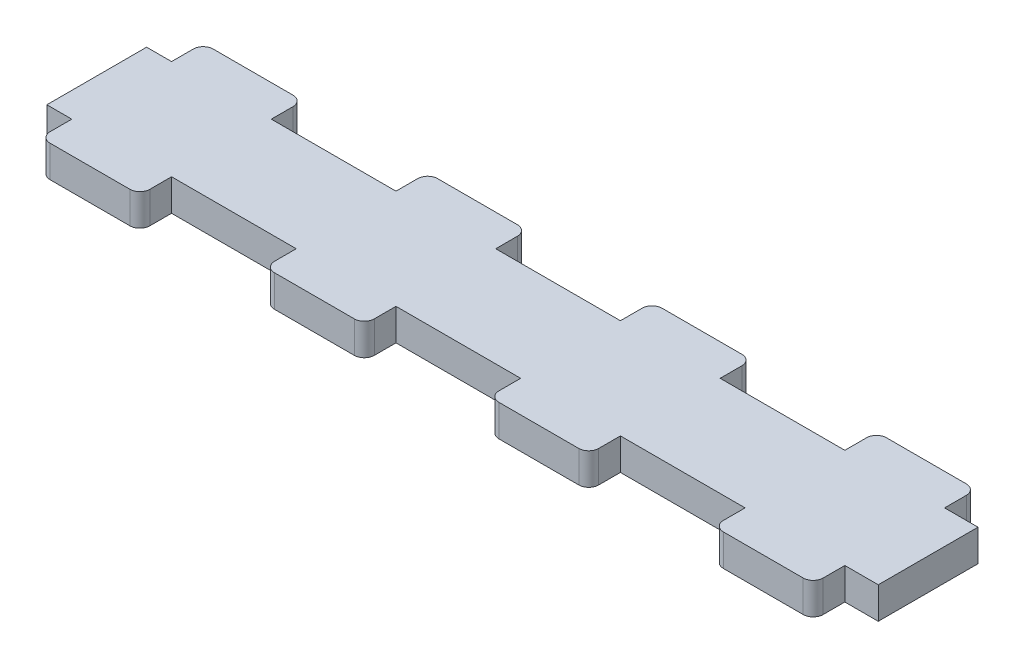
from build123d import *

# Parameters (mm, degrees)
BOSS_EXTRUDE1_DEPTH = 6.35
FILLET1_R           = 2


with BuildPart() as part:
    # Sketch1 → Boss-Extrude1 (new body)
    with BuildSketch(Plane(origin=(0, 0, 0), x_dir=(1, 0, 0), z_dir=(0, 1, 0))):
        Polygon((0, 0), (0, 10), (-6.7, 10), (-6.7, 16.35), (-26.7, 16.35), (-26.7, 10), (-51.7, 10), (-51.7, 16.35), (-71.7, 16.35), (-71.7, 10), (-96.7, 10), (-96.7, 16.35), (-116.7, 16.35), (-116.7, 10), (-141.7, 10), (-141.7, 16.35), (-161.7, 16.35), (-161.7, 10), (-166.7, 10), (-166.7, 0), (-166.7, -10), (-161.7, -10), (-161.7, -16.35), (-141.7, -16.35), (-141.7, -10), (-116.7, -10), (-116.7, -16.35), (-96.7, -16.35), (-96.7, -10), (-71.7, -10), (-71.7, -16.35), (-51.7, -16.35), (-51.7, -10), (-26.7, -10), (-26.7, -16.35), (-6.7, -16.35), (-6.7, -10), (0, -10), align=None)
    extrude(amount=BOSS_EXTRUDE1_DEPTH)

    # Fillet1
    fillet1_edges = [part.edges().sort_by_distance(p)[0] for p in [
        (-6.7, 3.175, 16.35),
        (-26.7, 3.175, 16.35),
        (-51.7, 3.175, 16.35),
        (-71.7, 3.175, 16.35),
        (-96.7, 3.175, 16.35),
        (-116.7, 3.175, 16.35),
        (-141.7, 3.175, 16.35),
        (-161.7, 3.175, 16.35),
        (-161.7, 3.175, -16.35),
        (-141.7, 3.175, -16.35),
        (-116.7, 3.175, -16.35),
        (-96.7, 3.175, -16.35),
        (-71.7, 3.175, -16.35),
        (-51.7, 3.175, -16.35),
        (-26.7, 3.175, -16.35),
        (-6.7, 3.175, -16.35),
    ]]
    fillet(fillet1_edges, radius=FILLET1_R)


solid = part.part
